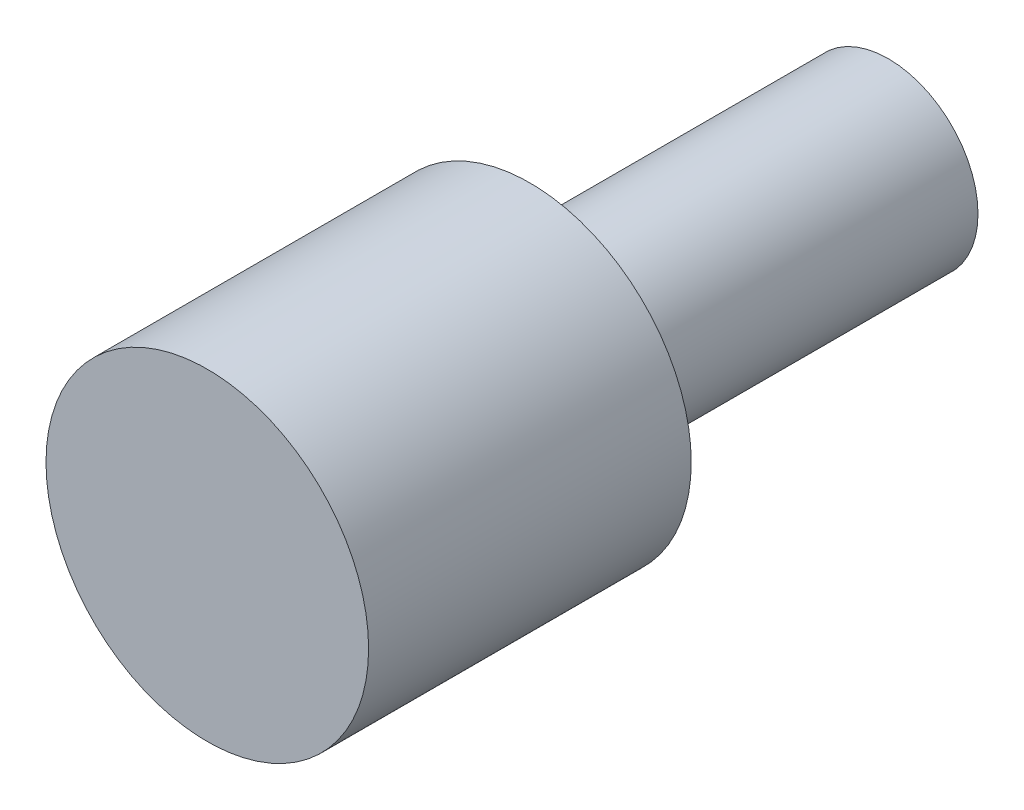
from build123d import *

# Parameters (mm, degrees)
SKETCH1_R           = 2.5
BOSS_EXTRUDE1_DEPTH = 10
SKETCH2_R           = 4.5
BOSS_EXTRUDE2_DEPTH = 9


with BuildPart() as part:
    # Sketch1 → Boss-Extrude1 (new body)
    with BuildSketch(Plane.XY):
        Circle(SKETCH1_R)
    extrude(amount=BOSS_EXTRUDE1_DEPTH)

    # Sketch2 → Boss-Extrude2 (add)
    with BuildSketch(Plane.XY.offset(10)):
        Circle(SKETCH2_R)
    extrude(amount=BOSS_EXTRUDE2_DEPTH)


solid = part.part
